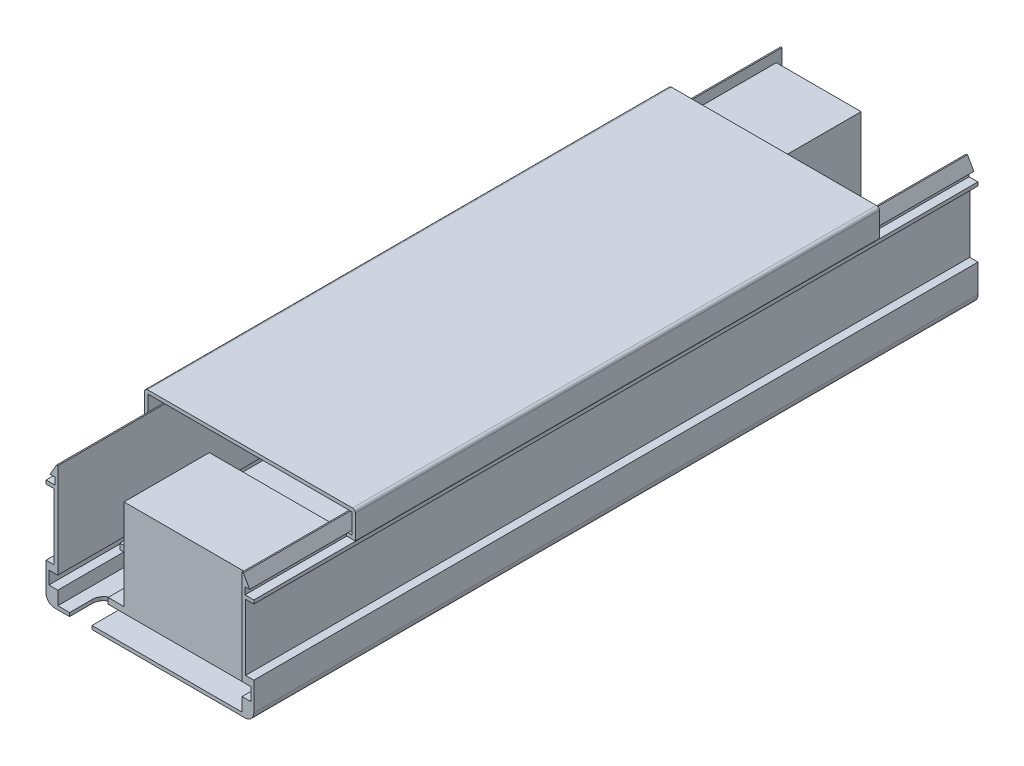
from build123d import *

# Parameters (mm, degrees)
EXTRUDE_1_DEPTH     = 61.5
EXTRUDE_2_DEPTH     = 44.5
SKETCH_4_W          = 31.2
SKETCH_4_H          = 1
EXTRUDE_3_DEPTH     = 60
SKETCH_5_W          = 14.4
SKETCH_5_H          = 14.5
SKETCH_5_W_2        = 21
EXTRUDE_4_DEPTH     = 15.4
SKETCH_6_W          = 7
SKETCH_6_H          = 9
CUT_EXTRUDE_1_DEPTH = 67.642478945
CUT_EXTRUDE_2_DEPTH = 68.85587668


with BuildPart() as part:
    # 草圖2 → 填料-伸長1 (new, symmetric)
    with BuildSketch(Plane.XY):
        with BuildLine():
            Line((16.15, 0), (-16.15, 0))
            ThreePointArc((-16.15, 0), (-17.210660172, 0.439339828), (-17.65, 1.5))
            Line((-17.65, 1.5), (-17.65, 6.3))
            Line((-17.65, 6.3), (-16.25, 6.3))
            Line((-16.25, 6.3), (-16.25, 17.5))
            Line((-16.25, 17.5), (-17.65, 17.5))
            Line((-17.65, 17.5), (-17.65, 18.1))
            Line((-17.65, 18.1), (-16.15, 18.1))
            Line((-16.15, 18.1), (-16.15, 19.3))
            Line((-16.15, 19.3), (-16.95, 19.3))
            Line((-16.95, 19.3), (-15.86, 21.2))
            Line((-15.86, 21.2), (-15.65, 21.2))
            Line((-15.65, 21.2), (-15.65, 5.1))
            Line((-15.65, 5.1), (-17.15, 5.1))
            Line((-17.15, 5.1), (-17.15, 2.9))
            Line((-17.15, 2.9), (-15.65, 2.9))
            Line((-15.65, 2.9), (-15.65, 0.6))
            Line((-15.65, 0.6), (15.65, 0.6))
            Line((15.65, 0.6), (15.65, 2.9))
            Line((15.65, 2.9), (17.15, 2.9))
            Line((17.15, 2.9), (17.15, 5.1))
            Line((17.15, 5.1), (15.65, 5.1))
            Line((15.65, 5.1), (15.65, 21.2))
            Line((15.65, 21.2), (15.86, 21.2))
            Line((15.86, 21.2), (16.95, 19.3))
            Line((16.95, 19.3), (16.15, 19.3))
            Line((16.15, 19.3), (16.15, 18.1))
            Line((16.15, 18.1), (17.65, 18.1))
            Line((17.65, 18.1), (17.65, 17.5))
            Line((17.65, 17.5), (16.25, 17.5))
            Line((16.25, 17.5), (16.25, 6.3))
            Line((16.25, 6.3), (17.65, 6.3))
            Line((17.65, 6.3), (17.65, 1.5))
            ThreePointArc((17.65, 1.5), (17.210660172, 0.439339828), (16.15, 0))
        make_face()
    extrude(amount=EXTRUDE_1_DEPTH, both=True)

    # 草圖7 → 除料-伸長2 (cut, through all)
    with BuildSketch(Plane(origin=(0, 0.6, 0), x_dir=(1, 0, 0), z_dir=(0, 1, 0))):
        with BuildLine():
            Line((9.35, 61.5), (13.15, 61.5))
            Line((13.15, 61.5), (13.15, 57.6))
            ThreePointArc((13.15, 57.6), (11.25, 55.7), (9.35, 57.6))
            Line((9.35, 57.6), (9.35, 61.5))
        make_face()
        with BuildLine():
            Line((-13.65, -61.5), (-13.65, -57.6))
            ThreePointArc((-13.65, -57.6), (-11.75, -55.7), (-9.85, -57.6))
            Line((-9.85, -57.6), (-9.85, -61.5))
            Line((-9.85, -61.5), (-13.65, -61.5))
        make_face()
    extrude(amount=-CUT_EXTRUDE_2_DEPTH, mode=Mode.SUBTRACT)


with BuildPart() as body_2:
    # 草圖3 → 填料-伸長2 (new, symmetric)
    with BuildSketch(Plane.XY):
        with BuildLine():
            Line((17.4, 23), (-17.4, 23))
            ThreePointArc((-17.4, 23), (-17.753553391, 22.853553391), (-17.9, 22.5))
            Line((-17.9, 22.5), (-17.9, 18.4))
            Line((-17.9, 18.4), (-16.35, 18.4))
            Line((-16.35, 18.4), (-16.35, 19))
            Line((-16.35, 19), (-17.3, 19))
            Line((-17.3, 19), (-17.3, 22.4))
            Line((-17.3, 22.4), (17.3, 22.4))
            Line((17.3, 22.4), (17.3, 19))
            Line((17.3, 19), (16.35, 19))
            Line((16.35, 19), (16.35, 18.4))
            Line((16.35, 18.4), (17.9, 18.4))
            Line((17.9, 18.4), (17.9, 22.5))
            ThreePointArc((17.9, 22.5), (17.753553391, 22.853553391), (17.4, 23))
        make_face()
    extrude(amount=EXTRUDE_2_DEPTH, both=True)


with BuildPart() as body_3:
    # 草圖4 → 填料-伸長3 (new, symmetric)
    with BuildSketch(Plane.XY):
        with Locations((0, 4.1)):
            Rectangle(SKETCH_4_W, SKETCH_4_H)
    extrude(amount=EXTRUDE_3_DEPTH, both=True)

    # 草圖5 → 填料-伸長4 (add)
    with BuildSketch(Plane(origin=(0, 4.6, 0), x_dir=(1, 0, 0), z_dir=(0, 1, 0))):
        with Locations((-7.9, 52.75)):
            Rectangle(SKETCH_5_W, SKETCH_5_H)
        with Locations((4.6, -52.75)):
            Rectangle(SKETCH_5_W_2, SKETCH_5_H)
    extrude(amount=EXTRUDE_4_DEPTH)

    # 草圖6 → 除料-伸長1 (cut, through all)
    with BuildSketch(Plane(origin=(0, 4.6, 0), x_dir=(1, 0, 0), z_dir=(0, 1, 0))):
        with Locations((12.1, 55.5)):
            Rectangle(SKETCH_6_W, SKETCH_6_H)
        with Locations((-12.1, -55.5)):
            Rectangle(SKETCH_6_W, SKETCH_6_H)
    extrude(amount=-CUT_EXTRUDE_1_DEPTH, mode=Mode.SUBTRACT)


solid = Compound([part.part, body_2.part, body_3.part])
